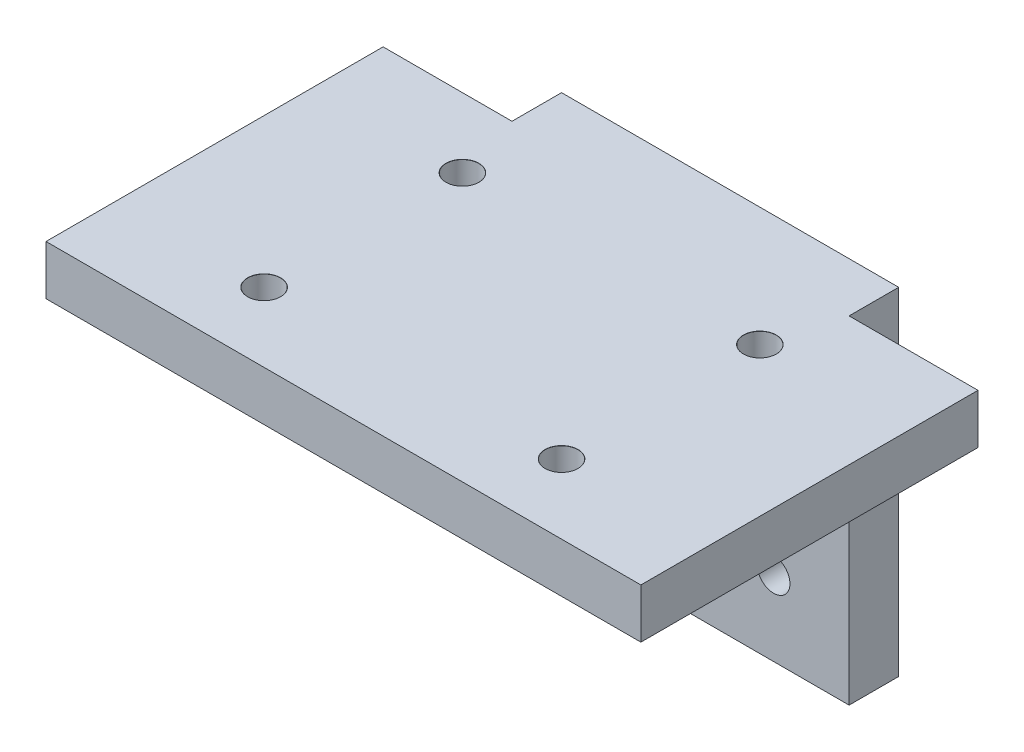
from build123d import *

# Parameters (mm, degrees)
SKETCH1_W                      = 68
SKETCH1_H                      = 68
SKETCH1_R                      = 14.29
BOSS_EXTRUDE1_DEPTH            = 10
M6_CLEARANCE_HOLE1_D           = 6.6
M6_CLEARANCE_HOLE1_CSINK_D     = 6.65
M6_CLEARANCE_HOLE1_CSINK_ANGLE = 100
SKETCH5_W                      = 120
SKETCH5_H                      = 10
BOSS_EXTRUDE3_DEPTH            = 68
M6_CLEARANCE_HOLE2_D           = 6.6
M6_CLEARANCE_HOLE2_CSINK_D     = 6.65
M6_CLEARANCE_HOLE2_CSINK_ANGLE = 100


with BuildPart() as part:
    # Sketch1 → Boss-Extrude1 (new body)
    with BuildSketch(Plane.XY):
        Rectangle(SKETCH1_W, SKETCH1_H)
        Circle(SKETCH1_R, mode=Mode.SUBTRACT)
    extrude(amount=BOSS_EXTRUDE1_DEPTH)

    # M6 Clearance Hole1 (through all)
    with Locations(Plane(origin=(0, 0, 0), x_dir=(-1, 0, 0), z_dir=(0, 0, -1))):
        with Locations((-18.768735293, 18.768735293), (18.768735293, 18.768735293), (-18.768735293, -18.768735293), (18.768735293, -18.768735293)):
            CounterSinkHole(M6_CLEARANCE_HOLE1_D / 2, M6_CLEARANCE_HOLE1_CSINK_D / 2, counter_sink_angle=M6_CLEARANCE_HOLE1_CSINK_ANGLE)

    # Sketch5 → Boss-Extrude3 (add)
    with BuildSketch(Plane.XY.offset(10)):
        with Locations((0, 29)):
            Rectangle(SKETCH5_W, SKETCH5_H)
    extrude(amount=BOSS_EXTRUDE3_DEPTH)

    # M6 Clearance Hole2 (through all)
    with Locations(Plane(origin=(0, 34, 0), x_dir=(1, 0, 0), z_dir=(0, 1, 0))):
        with Locations((-30, -24), (30, -24), (-30, -64), (30, -64)):
            CounterSinkHole(M6_CLEARANCE_HOLE2_D / 2, M6_CLEARANCE_HOLE2_CSINK_D / 2, counter_sink_angle=M6_CLEARANCE_HOLE2_CSINK_ANGLE)


solid = part.part
